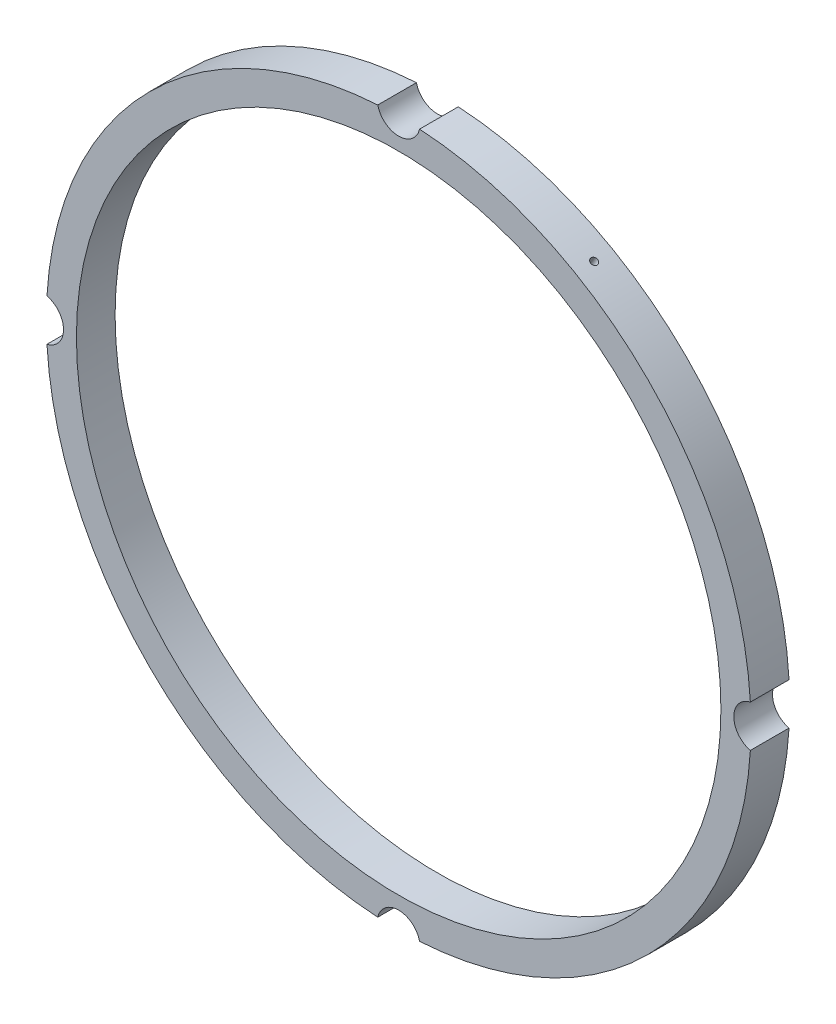
from build123d import *

# Parameters (mm, degrees)
SKETCH1_R                 = 82
SKETCH1_R_2               = 75
BOSS_EXTRUDE1_DEPTH       = 9
SKETCH2_R                 = 5
CUT_EXTRUDE1_DEPTH        = 117.314229568
CIRPATTERN1_COUNT         = 4
M2X0_4_TAPPED_HOLE1_D     = 1.6
M2X0_4_TAPPED_HOLE1_DEPTH = 10
M2X0_4_TAPPED_HOLE1_TIP   = 0.480688495


with BuildPart() as part:
    # Sketch1 → Boss-Extrude1 (new body)
    with BuildSketch(Plane.XY):
        Circle(SKETCH1_R)
        Circle(SKETCH1_R_2, mode=Mode.SUBTRACT)
    extrude(amount=BOSS_EXTRUDE1_DEPTH)

    # Sketch2 → Cut-Extrude1 (cut, through all)
    with BuildSketch(Plane.XY.offset(9)):
        with Locations((0, 83)):
            Circle(SKETCH2_R)
    cut_extrude1 = extrude(amount=-CUT_EXTRUDE1_DEPTH, mode=Mode.SUBTRACT)

    # CirPattern1: Cut-Extrude1 ×4 about axis
    cirpattern1_axis = Axis((0, 0, 0), (0, 0, 1))
    for i in range(1, CIRPATTERN1_COUNT):
        add(cut_extrude1.rotate(cirpattern1_axis, i * 360 / CIRPATTERN1_COUNT), mode=Mode.SUBTRACT)

    # M2x0.4 Tapped Hole1
    with Locations(Plane(origin=(41, 71.01408311, 4.5), x_dir=(0.866025403784, -0.5, 0), z_dir=(0.5, 0.866025403784, 0))):
        with Locations((0, 0)):
            Hole(M2X0_4_TAPPED_HOLE1_D / 2, depth=M2X0_4_TAPPED_HOLE1_DEPTH)
            with Locations((0, 0, -(M2X0_4_TAPPED_HOLE1_DEPTH + M2X0_4_TAPPED_HOLE1_TIP / 2))):  # 118° drill point
                Cone(0, M2X0_4_TAPPED_HOLE1_D / 2, M2X0_4_TAPPED_HOLE1_TIP, mode=Mode.SUBTRACT)


solid = part.part
